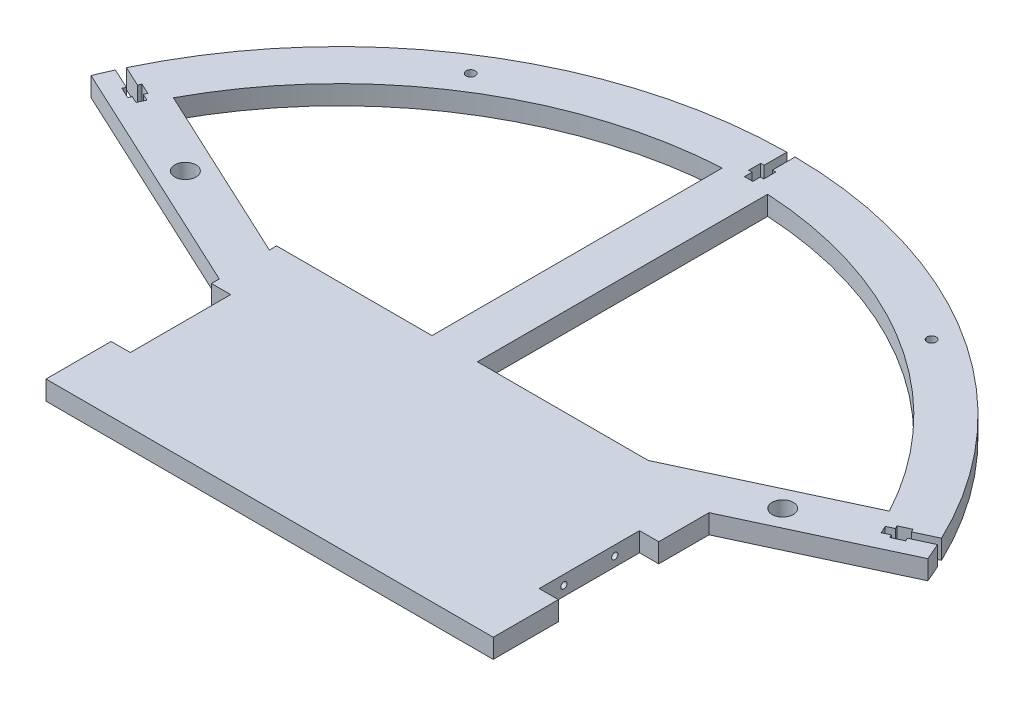
from build123d import *

# Parameters (mm, degrees)
BOSS_EXTRUDE1_DEPTH               = 3.175
SKETCH2_W                         = 2.75
SKETCH2_H                         = 2.5
SKETCH2_H_2                       = 4
SKETCH2_W_2                       = 1.125
SKETCH2_H_3                       = 7.5
CUT_EXTRUDE1_DEPTH                = 204.460831631
CIRPATTERN1_COUNT                 = 2
CIRPATTERN1_ANGLE                 = 65
CIRPATTERN1_THE_OTHER_WAY_COUNT   = 2
CIRPATTERN1_THE_OTHER_WAY_ANGLE   = 65
F_3_0_3_DIAMETER_HOLE1_D          = 3
SKETCH13_W                        = 6.35
SKETCH13_H                        = 33.16
CUT_EXTRUDE2_DEPTH                = 204.530492207
M2_5X0_45_TAPPED_HOLE1_AT_2_COUNT = 2
M2_5X0_45_TAPPED_HOLE1_AT_2_PITCH = 16.83
M6_CLEARANCE_HOLE1_D              = 7


with BuildPart() as part:
    # Sketch1 → Boss-Extrude1 (new, symmetric)
    with BuildSketch(Plane(origin=(0, 0, 0), x_dir=(1, 0, 0), z_dir=(0, 1, 0))):
        with BuildLine():
            Line((88.95, 33.202731801), (138.254290129, 56.193699868))
            ThreePointArc((138.254290129, 56.193699868), (0, 149.238), (-138.254290129, 56.193699868))
            Line((-138.254290129, 56.193699868), (-58.85, 19.16687129))
            Line((-58.85, 19.16687129), (-58.85, -38.1))
            Line((-58.85, -38.1), (88.95, -38.1))
            Line((88.95, -38.1), (88.95, 33.202731801))
        make_face()
        with BuildLine():
            Line((-7.5, 11.821590418), (-7.5, 11.772641828))
            Line((-7.5, 11.772641828), (-7.544362488, 11.793328396))
            ThreePointArc((-7.544362488, 11.793328396), (-7.522194517, 11.807480241), (-7.5, 11.821590418))
        make_face(mode=Mode.SUBTRACT)
        with BuildLine():
            ThreePointArc((7.5, 11.821590418), (7.522194517, 11.807480241), (7.544362488, 11.793328396))
            Line((7.544362488, 11.793328396), (7.5, 11.772641828))
            Line((7.5, 11.772641828), (7.5, 11.821590418))
        make_face(mode=Mode.SUBTRACT)
        with BuildLine():
            Line((-7.5, 134.028320306), (-7.5, 38.1))
            Line((-7.5, 38.1), (-58.85, 38.1))
            Line((-58.85, 38.1), (-58.85, 35.717540075))
            Line((-58.85, 35.717540075), (-118.301273414, 63.440124154))
            ThreePointArc((-118.301273414, 63.440124154), (-72.126024825, 113.215180903), (-7.5, 134.028320306))
        make_face(mode=Mode.SUBTRACT)
        with BuildLine():
            ThreePointArc((7.5, 134.028320306), (72.126024825, 113.215180903), (118.301273414, 63.440124154))
            Line((118.301273414, 63.440124154), (63.959201798, 38.1))
            Line((63.959201798, 38.1), (7.5, 38.1))
            Line((7.5, 38.1), (7.5, 134.028320306))
        make_face(mode=Mode.SUBTRACT)
    extrude(amount=BOSS_EXTRUDE1_DEPTH, both=True)

    # Sketch2 → Cut-Extrude1 (cut, symmetric)
    with BuildSketch(Plane(origin=(0, 0, 0), x_dir=(1, 0, 0), z_dir=(0, 1, 0))):
        with Locations((0, 136.488)):
            Rectangle(SKETCH2_W, SKETCH2_H)
        with Locations((0, 139.738)):
            Rectangle(SKETCH2_W, SKETCH2_H_2)
        with Locations((1.9375, 139.738)):
            Rectangle(SKETCH2_W_2, SKETCH2_H_2)
        with Locations((0, 145.488)):
            Rectangle(SKETCH2_W, SKETCH2_H_3)
        with Locations((-1.9375, 139.738)):
            Rectangle(SKETCH2_W_2, SKETCH2_H_2)
    cut_extrude1 = extrude(amount=CUT_EXTRUDE1_DEPTH, both=True, mode=Mode.SUBTRACT)

    # CirPattern1: Cut-Extrude1 ×2 about axis
    cirpattern1_axis = Axis((0, 0, 0), (0, 1, 0))
    for i in range(1, CIRPATTERN1_COUNT):
        add(cut_extrude1.rotate(cirpattern1_axis, i * CIRPATTERN1_ANGLE / (CIRPATTERN1_COUNT - 1)), mode=Mode.SUBTRACT)

    # CirPattern1 the other way: Cut-Extrude1 ×2 about axis
    cirpattern1_the_other_way_axis = Axis((0, 0, 0), (0, -1, 0))
    for i in range(1, CIRPATTERN1_THE_OTHER_WAY_COUNT):
        add(cut_extrude1.rotate(cirpattern1_the_other_way_axis, i * CIRPATTERN1_THE_OTHER_WAY_ANGLE / (CIRPATTERN1_THE_OTHER_WAY_COUNT - 1)), mode=Mode.SUBTRACT)

    # Ø3.0 (3) Diameter Hole1 (through all)
    with Locations(Plane(origin=(0, 3.175, 0), x_dir=(1, 0, 0), z_dir=(0, 1, 0))):
        with Locations((76.155771888, 119.540616747), (-76.155771888, 119.540616747)):
            Hole(F_3_0_3_DIAMETER_HOLE1_D / 2)

    # Sketch13 → Cut-Extrude2 (cut, through all)
    with BuildSketch(Plane(origin=(0, 3.175, 0), x_dir=(1, 0, 0), z_dir=(0, 1, 0))):
        with Locations((-55.675, 0)):
            Rectangle(SKETCH13_W, SKETCH13_H)
        with Locations((85.775, 0)):
            Rectangle(SKETCH13_W, SKETCH13_H)
    extrude(amount=-CUT_EXTRUDE2_DEPTH, mode=Mode.SUBTRACT)

    # Sketch15 → M2.5x0.45 Tapped Hole1 (revolve, cut)
    with BuildSketch(Plane(origin=(-52.5, 0, -8.415), x_dir=(0, 0, 1), z_dir=(0, 1, 0))):
        Polygon((0, 0), (0, 6.965882135), (1.025, 6.35), (1.025, 0), align=None)
    m2_5x0_45_tapped_hole1 = revolve(axis=Axis((-58.85, 0, -8.415), (1, 0, 0)), mode=Mode.SUBTRACT)

    # M2.5x0.45 Tapped Hole1 at 2: M2.5x0.45 Tapped Hole1 ×2
    with Locations(*[(0, 0, i * M2_5X0_45_TAPPED_HOLE1_AT_2_PITCH) for i in range(1, M2_5X0_45_TAPPED_HOLE1_AT_2_COUNT)]):
        add(m2_5x0_45_tapped_hole1, mode=Mode.SUBTRACT)

    # Mirror1: M2.5x0.45 Tapped Hole1 across plane
    add(m2_5x0_45_tapped_hole1.mirror(Plane.ZY.offset(-15.05)), mode=Mode.SUBTRACT)

    # Mirror1 copy 1 sketch → Mirror1 copy 1 (revolve, cut)
    with BuildSketch(Plane(origin=(82.6, 0, 8.415), x_dir=(0, 0, 1), z_dir=(0, 1, 0))):
        Polygon((0, 0), (0, -6.965882135), (1.025, -6.35), (1.025, 0), align=None)
    revolve(axis=Axis((88.95, 0, 8.415), (1, 0, 0)), mode=Mode.SUBTRACT)

    # M6 Clearance Hole1 (through all)
    with Locations(Plane(origin=(0, 3.175, 0), x_dir=(1, 0, 0), z_dir=(0, 1, 0))):
        with Locations((99.909557827, 46.588591938), (-95.378018892, 44.475500629)):
            Hole(M6_CLEARANCE_HOLE1_D / 2)


solid = part.part
